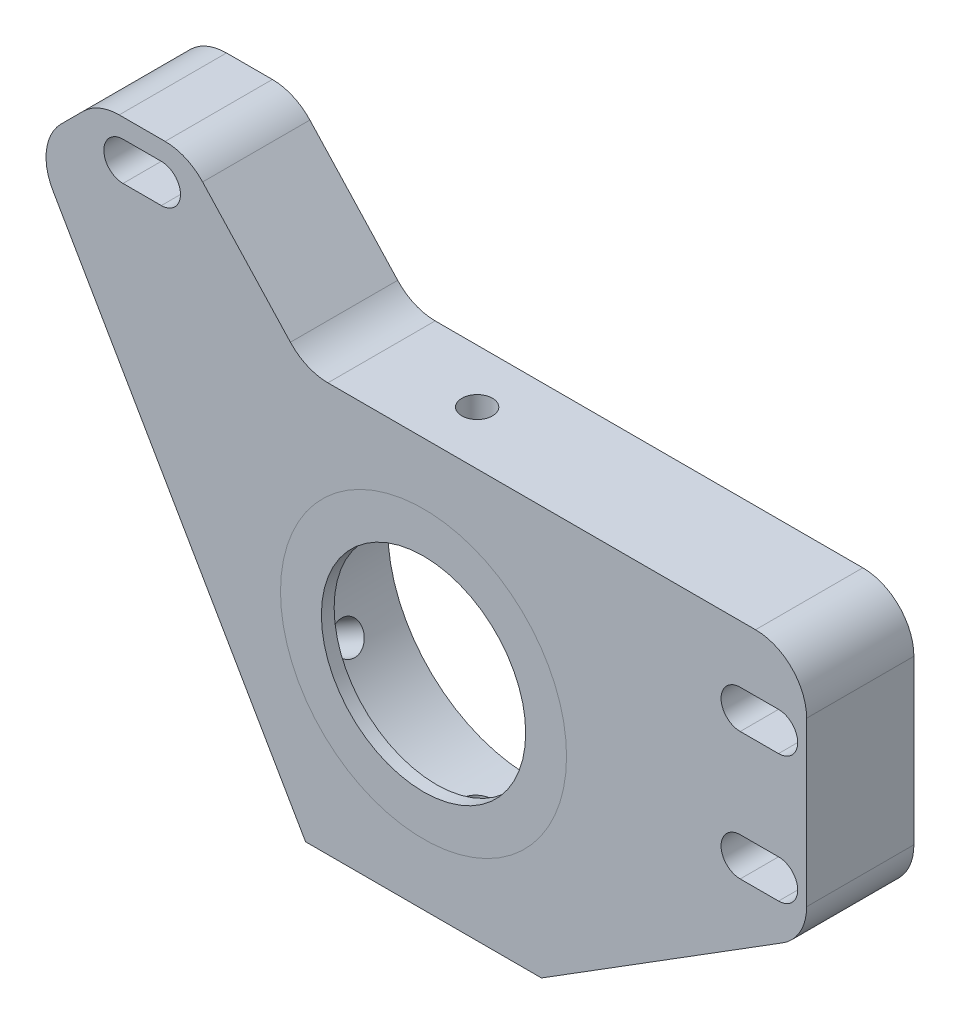
from build123d import *

# Parameters (mm, degrees)
DODANIE_WYCI_GNI_CIE1_DEPTH = 8.4
SZKIC2_R                    = 11.2
WYTNIJ_WYCI_GNI_CIE1_DEPTH  = 44.219131566
SZKIC3_R                    = 1.2
WYTNIJ_WYCI_GNI_CIE2_DEPTH  = 48.073276212
SZKIC4_R                    = 1.2
WYTNIJ_WYCI_GNI_CIE3_DEPTH  = 10
SZKIC5_R                    = 11.2
SZKIC5_R_2                  = 8
DODANIE_WYCI_GNI_CIE2_DEPTH = 1
SFAZOWANIE1_SIZE            = 8
SFAZOWANIE1_SIZE2           = 5.856406461
ZAOKR_GLENIE2_R             = 4
WYTNIJ_WYCI_GNI_CIE4_DEPTH  = 41.577826478


with BuildPart() as part:
    # Szkic1 → Dodanie-wyciągnięcie1 (new body)
    with BuildSketch(Plane.XY):
        Polygon((30, 16), (-9.237604307, 16), (-18.486315613, 26), (-33.486315613, 26), (-9.237604307, -16), (9.237604307, -16), (30, -3), align=None)
    extrude(amount=DODANIE_WYCI_GNI_CIE1_DEPTH)

    # Szkic2 → Wytnij-wyciągnięcie1 (cut, through all)
    with BuildSketch(Plane.XY.offset(8.4)):
        Circle(SZKIC2_R)
    extrude(amount=-WYTNIJ_WYCI_GNI_CIE1_DEPTH, mode=Mode.SUBTRACT)

    # Szkic3 → Wytnij-wyciągnięcie2 (cut, through all)
    with BuildSketch(Plane(origin=(0, 16, 0), x_dir=(1, 0, 0), z_dir=(0, 1, 0))):
        with Locations(Location((0, -4.2, 0), (0, 0, 180))):
            Circle(SZKIC3_R)
    extrude(amount=-WYTNIJ_WYCI_GNI_CIE2_DEPTH, mode=Mode.SUBTRACT)

    # Szkic4 → Wytnij-wyciągnięcie3 (cut)
    with BuildSketch(Plane(origin=(-13.856406461, -8, 0), x_dir=(0, 0, 1), z_dir=(-0.8660254037844386, -0.5, 0))):
        with Locations(Location((4.2, 0.981596763, 0), (0, 0, 270))):
            Circle(SZKIC4_R)
    extrude(amount=-WYTNIJ_WYCI_GNI_CIE3_DEPTH, mode=Mode.SUBTRACT)

    # Sfazowanie1
    sfazowanie1_edges = [part.edges().sort_by_distance(p)[0] for p in [
        (-33.486315613, 26, 4.2),
    ]]
    sfazowanie1_side = [part.faces().sort_by_distance(p)[0] for p in [
        (-25.986315613, 26, 4.2),
    ]]
    chamfer(sfazowanie1_edges, length=SFAZOWANIE1_SIZE, length2=SFAZOWANIE1_SIZE2, reference=sfazowanie1_side[0])

    # Zaokrąglenie2
    zaokr_glenie2_edges = [part.edges().sort_by_distance(p)[0] for p in [
        (30, -3, 4.2),
        (-18.486315613, 26, 4.2),
        (-9.237604307, 16, 4.2),
        (30, 16, 4.2),
        (-30.558112383, 20.92820323, 4.2),
        (-25.486315613, 26, 4.2),
    ]]
    fillet(zaokr_glenie2_edges, radius=ZAOKR_GLENIE2_R)

    # Szkic6 → Wytnij-wyciągnięcie4 (cut, through all)
    with BuildSketch(Plane.XY.offset(8.4)):
        with BuildLine():
            Line((24.8, 1.5), (27.8, 1.5))
            ThreePointArc((27.8, 1.5), (29.3, 0), (27.8, -1.5))
            Line((27.8, -1.5), (24.8, -1.5))
            ThreePointArc((24.8, -1.5), (23.3, 0), (24.8, 1.5))
        make_face()
        with BuildLine():
            Line((24.8, 11.5), (27.8, 11.5))
            ThreePointArc((27.8, 11.5), (29.3, 10), (27.8, 8.5))
            Line((27.8, 8.5), (24.8, 8.5))
            ThreePointArc((24.8, 8.5), (23.3, 10), (24.8, 11.5))
        make_face()
        with BuildLine():
            Line((-23.532397763, 24.5), (-20.532397763, 24.5))
            ThreePointArc((-20.532397763, 24.5), (-19.032397763, 23), (-20.532397763, 21.5))
            Line((-20.532397763, 21.5), (-23.532397763, 21.5))
            ThreePointArc((-23.532397763, 21.5), (-25.032397763, 23), (-23.532397763, 24.5))
        make_face()
    extrude(amount=-WYTNIJ_WYCI_GNI_CIE4_DEPTH, mode=Mode.SUBTRACT)


with BuildPart() as body_2:
    # Szkic5 → Dodanie-wyciągnięcie2 (new body)
    with BuildSketch(Plane.XY.offset(8.4)):
        Circle(SZKIC5_R)
        Circle(SZKIC5_R_2, mode=Mode.SUBTRACT)
    extrude(amount=-DODANIE_WYCI_GNI_CIE2_DEPTH)


solid = Compound([part.part, body_2.part])
